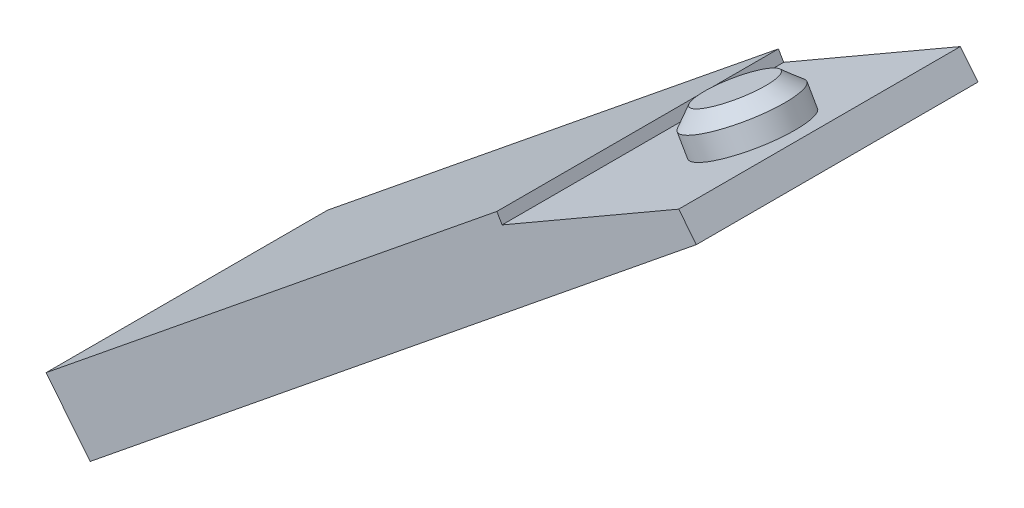
from build123d import *

# Parameters (mm, degrees)
EXTRUDE_1_DEPTH     = 9
SKETCH_2_R          = 3.5
CUT_EXTRUDE_1_DEPTH = 18
EXTRUDE_2_DEPTH     = 10
EXTRUDE_START       = 2.5
SKETCH_4_R          = 3.5
EXTRUDE_3_DEPTH     = 2.5
CHAMFER_1_SIZE      = 1
EXTRUDE_4_DEPTH     = 10
SKETCH_7_W          = 63.046601733
SKETCH_7_H          = 81.446187988
CUT_EXTRUDE_2_DEPTH = 10
SKETCH_8_W          = 55.396674472
SKETCH_8_H          = 20
EXTRUDE_5_DEPTH     = 2


with BuildPart() as part:
    # 草图1 → 凸台-拉伸1 (new, symmetric)
    with BuildSketch(Plane.XY):
        with BuildLine():
            Line((-38.810889132, -2.777568136), (-8.5, 14.722431864))
            ThreePointArc((-8.5, 14.722431864), (-1.481647627, 16.935309868), (5.814342437, 15.974774553))
            Line((5.814342437, 15.974774553), (6.498382723, 17.854159795))
            ThreePointArc((6.498382723, 17.854159795), (-1.655959112, 18.927699264), (-9.5, 16.454482672))
            Line((-9.5, 16.454482672), (-39.810889132, -1.045517328))
            Line((-39.810889132, -1.045517328), (-38.810889132, -2.777568136))
        make_face()
    extrude(amount=EXTRUDE_1_DEPTH, both=True)

    # 草图2 → 切除-拉伸1 (cut)
    with BuildSketch(Plane(origin=(-9.5, 16.454482672, 0), x_dir=(0.8660254037844398, 0.49999999999999806, 0), z_dir=(-0.49999999999999806, 0.8660254037844398, 0))):
        with Locations(Location((-26, 0, 0), (0, 0, 180))):
            Circle(SKETCH_2_R)
    extrude(amount=-CUT_EXTRUDE_1_DEPTH, mode=Mode.SUBTRACT)

    # 草图7 → 切除-拉伸2 (cut, symmetric)
    with BuildSketch(Plane.XY):
        with Locations((-23.889592718, 14.899687111)):
            Rectangle(SKETCH_7_W, SKETCH_7_H)
    extrude(amount=CUT_EXTRUDE_2_DEPTH, both=True, mode=Mode.SUBTRACT)


with BuildPart() as body_2:
    # 草图3 → 凸台-拉伸2 (new, symmetric)
    with BuildSketch(Plane.XY):
        Polygon((-26.266761163, 4.464787524), (-69.318063007, -30.397469317), (-71.206024181, -28.066031433), (-42.87484181, -5.123892308), align=None)
    extrude(amount=EXTRUDE_2_DEPTH, both=True)

    # 草图4 → 凸台-拉伸3 (add)
    with BuildSketch(Plane(origin=(-8.5, 14.722431864, 0), x_dir=(0.8660254037844386, 0.5000000000000001, 0), z_dir=(-0.5000000000000001, 0.8660254037844386, 0)).offset(EXTRUDE_START)):
        with Locations((-26, 0)):
            Circle(SKETCH_4_R)
    extrude(amount=-EXTRUDE_3_DEPTH)

    # 倒角1
    chamfer_1_edges = [body_2.edges().sort_by_distance(p)[0] for p in [
        (-35.297749412, 2.137495374, 0),
    ]]
    chamfer(chamfer_1_edges, length=CHAMFER_1_SIZE)

    # 草图6 → 凸台-拉伸4 (add, symmetric)
    with BuildSketch(Plane.XY):
        Polygon((-38.810889132, -2.777568136), (-39.182510373, -2.133901265), (-42.87484181, -5.123892308), align=None)
    extrude(amount=EXTRUDE_4_DEPTH, both=True)

    # 草图8 → 凸台-拉伸5 (add)
    with BuildSketch(Plane(origin=(-12.586407821, 15.542919229, 0), x_dir=(0.7771459614569706, 0.6293203910498378, 0), z_dir=(0.6293203910498378, -0.7771459614569706, 0))):
        with Locations((-45.301662764, 0)):
            Rectangle(SKETCH_8_W, SKETCH_8_H)
    extrude(amount=EXTRUDE_5_DEPTH)


solid = body_2.part
